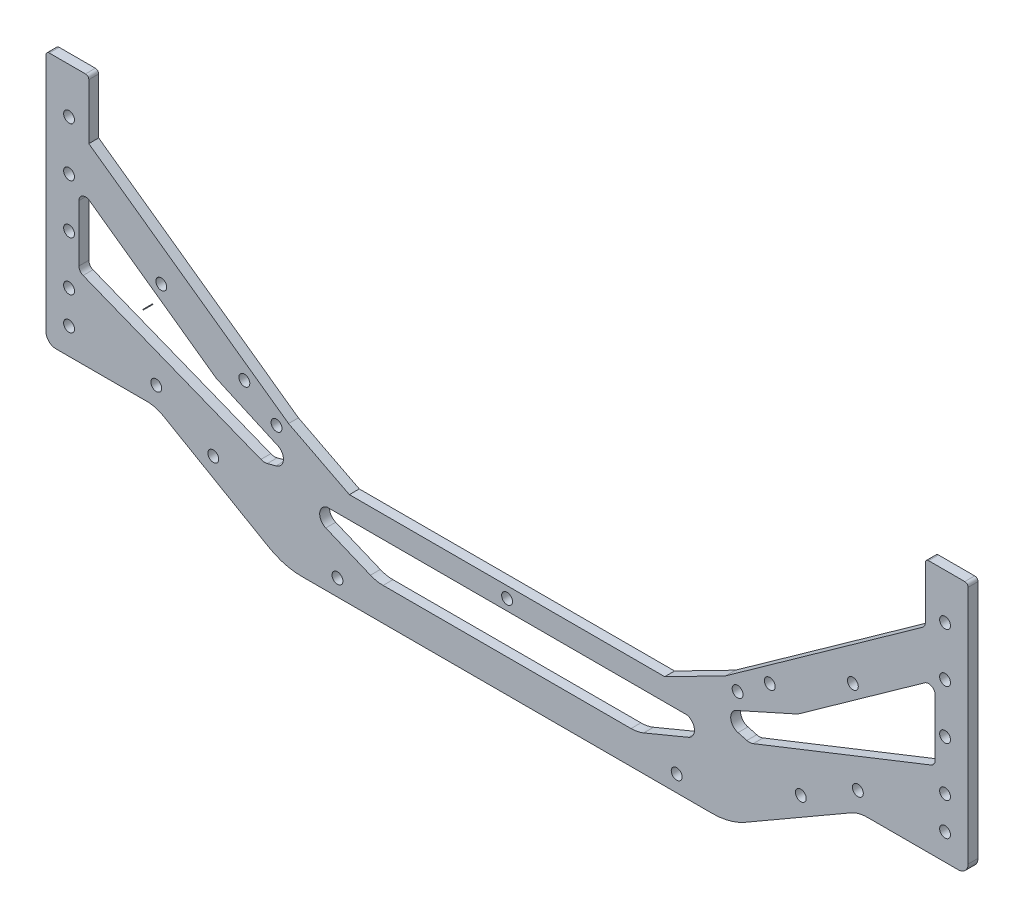
from build123d import *

# Parameters (mm, degrees)
SKETCH_1_R           = 1.65
EXTRUDE_1_DEPTH      = 3
FILLET_1_R           = 20
SKETCH_2_R           = 1.65
CUT_EXTRUDE_1_DEPTH  = 10
EXTRUDE_2_DEPTH      = 3
FILLET_2_R           = 10
EXTRUDE_3_DEPTH      = 3
FILLET_3_R           = 10
FILLET_4_R           = 3
SKETCH_6_R           = 1.65
CUT_EXTRUDE_2_DEPTH  = 5
EXTRUDE_4_DEPTH      = 3
SKETCH_8_R           = 1.65
CUT_EXTRUDE_3_DEPTH  = 10
EXTRUDE_5_DEPTH      = 3
FILLET_5_R           = 3
EXTRUDE_6_DEPTH      = 3
FILLET_6_R           = 2
SKETCH_11_W          = 10
SKETCH_11_H          = 67.386751346
EXTRUDE_7_DEPTH      = 3
SKETCH_14_W          = 280
SKETCH_14_H          = 9.594497852
CUT_EXTRUDE_6_DEPTH  = 30
CUT_EXTRUDE_START    = -10
CUT_EXTRUDE_7_DEPTH  = 10
EXTRUDE_12_DEPTH     = 3
EXTRUDE_15_DEPTH     = 3
CUT_EXTRUDE_10_DEPTH = 10
SKETCH_22_W          = 10
SKETCH_22_H          = 17.468473847
EXTRUDE_16_DEPTH     = 3
CUT_EXTRUDE_11_DEPTH = 10
CUT_EXTRUDE_12_DEPTH = 10
SKETCH_25_W          = 280
SKETCH_25_H          = 3
CUT_EXTRUDE_13_DEPTH = 10
SKETCH_26_W          = 3
SKETCH_26_H          = 35
EXTRUDE_17_DEPTH     = 3
SKETCH_27_R          = 1.65
CUT_EXTRUDE_14_DEPTH = 10
FILLET_7_R           = 1
SKETCH_28_R          = 1.65
EXTRUDE_18_DEPTH     = 3
EXTRUDE_19_DEPTH     = 3
EXTRUDE_20_DEPTH     = 3
CUT_EXTRUDE_15_DEPTH = 192.383166344
CUT_EXTRUDE_16_DEPTH = 192.383166344
SKETCH_33_R          = 1.65
CUT_EXTRUDE_17_DEPTH = 192.383166344
FILLET_8_R           = 2
SKETCH_34_R          = 1.65
EXTRUDE_21_DEPTH     = 3
SKETCH_35_R          = 1.65
CUT_EXTRUDE_18_DEPTH = 10
SKETCH_36_R          = 1.65
CUT_EXTRUDE_19_DEPTH = 10


with BuildPart() as part:
    # 草图1 → 凸台-拉伸1 (new body)
    with BuildSketch(Plane.XY):
        Polygon((91.5, 5), (156.5, 42.527767497), (161.5, 33.867513459), (94.179491924, -5), (-41.179491924, -5), (-108.5, 33.867513459), (-103.5, 42.527767497), (-38.5, 5), align=None)
        with Locations((53, 0)):
            Circle(SKETCH_1_R, mode=Mode.SUBTRACT)
        Circle(SKETCH_1_R, mode=Mode.SUBTRACT)
    extrude(amount=EXTRUDE_1_DEPTH)

    # 圆角1
    fillet_1_edges = [part.edges().sort_by_distance(p)[0] for p in [
        (94.179491924, -5, 1.5),
        (-41.179491924, -5, 1.5),
        (-38.5, 5, 1.5),
        (91.5, 5, 1.5),
    ]]
    fillet(fillet_1_edges, radius=FILLET_1_R)

    # 草图2 → 切除-拉伸1 (cut)
    with BuildSketch(Plane.XY.offset(3)):
        with Locations((-62.698729811, 13.197640478)):
            Circle(SKETCH_2_R)
        with Locations((-80.019237886, 23.197640478)):
            Circle(SKETCH_2_R)
        with Locations((133.019237886, 23.197640478)):
            Circle(SKETCH_2_R)
        with Locations((115.698729811, 13.197640478)):
            Circle(SKETCH_2_R)
        with Locations((-25, 0)):
            Circle(SKETCH_2_R)
        with Locations((78, 0)):
            Circle(SKETCH_2_R)
    extrude(amount=-CUT_EXTRUDE_1_DEPTH, mode=Mode.SUBTRACT)

    # 草图3 → 凸台-拉伸2 (add)
    with BuildSketch(Plane.XY.offset(3)):
        with BuildLine():
            Line((-103.5, 42.527767497), (-13.141016151, 5))
            Line((-13.141016151, 5), (-33.141016151, 5))
            ThreePointArc((-33.141016151, 5), (-38.317397053, 5.681483474), (-43.141016151, 7.679491924))
            Line((-43.141016151, 7.679491924), (-103.5, 42.527767497))
        make_face()
        with BuildLine():
            Line((156.5, 42.527767497), (66.141016151, 5))
            Line((66.141016151, 5), (86.141016151, 5))
            ThreePointArc((86.141016151, 5), (91.317397053, 5.681483474), (96.141016151, 7.679491924))
            Line((96.141016151, 7.679491924), (156.5, 42.527767497))
        make_face()
    extrude(amount=-EXTRUDE_2_DEPTH)

    # 圆角2
    fillet_2_edges = [part.edges().sort_by_distance(p)[0] for p in [
        (66.141016151, 5, 1.5),
        (-13.141016151, 5, 1.5),
    ]]
    fillet(fillet_2_edges, radius=FILLET_2_R)

    # 草图4 → 凸台-拉伸3 (add)
    with BuildSketch(Plane.XY.offset(3)):
        Polygon((-103.5, 42.527767497), (-108.5, 33.867513459), (-80.198729811, 17.527767497), (-113.5, 17.527767497), (-113.5, 42.527767497), align=None)
        Polygon((166.5, 17.527767497), (166.5, 42.527767497), (156.5, 42.527767497), (161.5, 33.867513459), (133.198729811, 17.527767497), align=None)
    extrude(amount=-EXTRUDE_3_DEPTH)

    # 圆角3
    fillet_3_edges = [part.edges().sort_by_distance(p)[0] for p in [
        (-80.198729811, 17.527767497, 1.5),
        (133.198729811, 17.527767497, 1.5),
    ]]
    fillet(fillet_3_edges, radius=FILLET_3_R)

    # 圆角4
    fillet_4_edges = [part.edges().sort_by_distance(p)[0] for p in [
        (-113.5, 42.527767497, 1.5),
        (-113.5, 17.527767497, 1.5),
        (166.5, 17.527767497, 1.5),
        (166.5, 42.527767497, 1.5),
    ]]
    fillet(fillet_4_edges, radius=FILLET_4_R)

    # 草图6 → 切除-拉伸2 (cut)
    with BuildSketch(Plane.XY.offset(3)):
        with Locations((-106.5, 35.527767497)):
            Circle(SKETCH_6_R)
        with Locations((-106.5, 25.527767497)):
            Circle(SKETCH_6_R)
        with Locations((159.5, 25.527767497)):
            Circle(SKETCH_6_R)
        with Locations((159.5, 35.527767497)):
            Circle(SKETCH_6_R)
    extrude(amount=-CUT_EXTRUDE_2_DEPTH, mode=Mode.SUBTRACT)

    # 草图7 → 凸台-拉伸4 (add)
    with BuildSketch(Plane.XY.offset(3)):
        Polygon((-47.30740392, 19.189936648), (-13.5, 28.248603227), (26.5, 28.248603227), (66.5, 28.248603227), (100.30740392, 19.189936648), (98.495670604, 12.428455864), (65.578432517, 21.248603227), (26.5, 21.248603227), (-12.578432517, 21.248603227), (-45.495670604, 12.428455864), align=None)
    extrude(amount=-EXTRUDE_4_DEPTH)

    # 草图8 → 切除-拉伸3 (cut)
    with BuildSketch(Plane.XY.offset(3)):
        with Locations((-106.5, 25.527767497)):
            Circle(SKETCH_8_R)
        with Locations((-106.5, 35.527767497)):
            Circle(SKETCH_8_R)
        with Locations((-98.5, 35.527767497)):
            Circle(SKETCH_8_R)
        with Locations((-98.5, 25.527767497)):
            Circle(SKETCH_8_R)
        with Locations((151.5, 25.527767497)):
            Circle(SKETCH_8_R)
        with Locations((151.5, 35.527767497)):
            Circle(SKETCH_8_R)
        with Locations((159.5, 35.527767497)):
            Circle(SKETCH_8_R)
        with Locations((159.5, 25.527767497)):
            Circle(SKETCH_8_R)
    extrude(amount=-CUT_EXTRUDE_3_DEPTH, mode=Mode.SUBTRACT)

    # 草图9 → 凸台-拉伸5 (add)
    with BuildSketch(Plane.XY.offset(3)):
        Polygon((-13.5, 28.248603227), (-110.911809549, 54.350018929), (-113.5, 44.690760666), (-32.818516526, 23.072222325), align=None)
        Polygon((166.5, 44.690760666), (85.818516526, 23.072222325), (66.5, 28.248603227), (163.911809549, 54.350018929), align=None)
    extrude(amount=-EXTRUDE_5_DEPTH)

    # 圆角5
    fillet_5_edges = [part.edges().sort_by_distance(p)[0] for p in [
        (89.701118587, 14.784948975, 1.5),
        (-36.701118587, 14.784948975, 1.5),
        (-47.30740392, 19.189936648, 1.5),
        (-13.5, 28.248603227, 1.5),
        (66.5, 28.248603227, 1.5),
        (100.30740392, 19.189936648, 1.5),
        (65.578432517, 21.248603227, 1.5),
        (-12.578432517, 21.248603227, 1.5),
        (-32.818516526, 23.072222325, 1.5),
        (-113.5, 44.690760666, 1.5),
        (-110.911809549, 54.350018929, 1.5),
        (163.911809549, 54.350018929, 1.5),
        (166.5, 44.690760666, 1.5),
        (85.818516526, 23.072222325, 1.5),
    ]]
    fillet(fillet_5_edges, radius=FILLET_5_R)

    # 草图10 → 凸台-拉伸6 (add)
    with BuildSketch(Plane.XY.offset(3)):
        Polygon((-108.357699123, 67.863132863), (-113.5, 61.734777318), (-101.784601755, 51.904390971), (-83.5, 47.005046697), align=None)
        Polygon((136.5, 47.005046697), (161.357699123, 67.863132863), (166.5, 61.734777318), (154.784601755, 51.904390971), align=None)
    extrude(amount=-EXTRUDE_6_DEPTH)

    # 圆角6
    fillet_6_edges = [part.edges().sort_by_distance(p)[0] for p in [
        (161.357699123, 67.863132863, 1.5),
        (166.5, 61.734777318, 1.5),
        (154.784601755, 51.904390971, 1.5),
        (136.5, 47.005046697, 1.5),
        (-83.5, 47.005046697, 1.5),
        (-101.784601755, 51.904390971, 1.5),
        (-108.357699123, 67.863132863, 1.5),
        (-113.5, 61.734777318, 1.5),
    ]]
    fillet(fillet_6_edges, radius=FILLET_6_R)

    # 草图11 → 凸台-拉伸7 (add)
    with BuildSketch(Plane.XY.offset(3)):
        with Locations((-108.5, 73.22114317)):
            Rectangle(SKETCH_11_W, SKETCH_11_H)
        with Locations((161.5, 73.22114317)):
            Rectangle(SKETCH_11_W, SKETCH_11_H)
    extrude(amount=-EXTRUDE_7_DEPTH)

    # 草图14 → 切除-拉伸6 (cut)
    with BuildSketch(Plane.XY.offset(3)):
        with Locations((26.5, 102.117269917)):
            Rectangle(SKETCH_14_W, SKETCH_14_H)
    extrude(amount=-CUT_EXTRUDE_6_DEPTH, mode=Mode.SUBTRACT)

    # 草图15 → 切除-拉伸7 (cut)
    with BuildSketch(Plane.XY.offset(3).offset(CUT_EXTRUDE_START)):
        with BuildLine():
            Line((-48.249337431, 19.581139164), (-113.5, 45.414518843))
            Line((-113.5, 45.414518843), (-113.5, 58.923894244))
            Line((-113.5, 58.923894244), (-71.81419, 33.52108154))
            Line((-71.81419, 33.52108154), (-43.633169306, 25.969999804))
            ThreePointArc((-43.633169306, 25.969999804), (-41.409626441, 23.072222325), (-43.633169306, 20.174444846))
            Line((-43.633169306, 20.174444846), (-46.322217276, 19.453916614))
            ThreePointArc((-46.322217276, 19.453916614), (-47.29629502, 19.358210154), (-48.249337431, 19.581139164))
        make_face()
        with BuildLine():
            Line((124.81419, 33.52108154), (96.633169306, 25.969999804))
            ThreePointArc((96.633169306, 25.969999804), (94.409626441, 23.072222325), (96.633169306, 20.174444846))
            Line((96.633169306, 20.174444846), (99.322217276, 19.453916614))
            ThreePointArc((99.322217276, 19.453916614), (100.29629502, 19.358210154), (101.249337431, 19.581139164))
            Line((101.249337431, 19.581139164), (166.5, 45.414518843))
            Line((166.5, 45.414518843), (166.5, 58.923894244))
            Line((166.5, 58.923894244), (124.81419, 33.52108154))
        make_face()
    extrude(amount=CUT_EXTRUDE_7_DEPTH, mode=Mode.SUBTRACT)

    # 草图16 → 凸台-拉伸12 (add)
    with BuildSketch(Plane.XY.offset(3)):
        Polygon((-48.476609221, 37.620557422), (-84.079864377, 40.954872502), (-103.5, 62.787039321), (-103.5, 65.787039321), align=None)
        Polygon((101.476609221, 37.620557422), (136.723834597, 40.954872502), (156.5, 62.787039321), (156.5, 65.787039321), align=None)
    extrude(amount=-EXTRUDE_12_DEPTH)

    # 草图20 → 凸台-拉伸15 (add)
    with BuildSketch(Plane.XY.offset(3)):
        Polygon((81.177744498, 17.068780179), (-28.177744498, 17.068780179), (-12.183475024, 24.145273244), (57.513790466, 24.145273244), align=None)
    extrude(amount=-EXTRUDE_15_DEPTH)

    # 草图21 → 切除-拉伸10 (cut)
    with BuildSketch(Plane(origin=(0, 0, 0), x_dir=(-1, 0, 0), z_dir=(0, 0, -1))):
        Polygon((-101.476609221, 37.620557422), (-74.37766377, 23.748603227), (21.37766377, 23.748603227), (46.90096027, 36.81398249), align=None)
    extrude(amount=-CUT_EXTRUDE_10_DEPTH, mode=Mode.SUBTRACT)

    # 草图22 → 凸台-拉伸16 (add)
    with BuildSketch(Plane.XY.offset(3)):
        with Locations((-108.5, 50.189657321)):
            Rectangle(SKETCH_22_W, SKETCH_22_H)
        with Locations((161.5, 50.189657321)):
            Rectangle(SKETCH_22_W, SKETCH_22_H)
    extrude(amount=-EXTRUDE_16_DEPTH)

    # 草图23 → 切除-拉伸11 (cut)
    with BuildSketch(Plane.XY.offset(3)):
        Polygon((-103.5, 52.830018965), (-43.633169306, 25.969999804), (-71.81419, 33.52108154), align=None)
        Polygon((96.633169306, 25.969999804), (156.5, 52.830018965), (124.81419, 33.52108154), align=None)
    extrude(amount=-CUT_EXTRUDE_11_DEPTH, mode=Mode.SUBTRACT)


with BuildPart() as cut_extrude_11_piece_1:
    # of the separate pieces the step leaves, piece 1, a body of its own (cut_extrude_11_pieces)
    add(part.part.solids().sort_by_distance((-113.5, 20.527767497, 0))[0])

    # 草图24 → 切除-拉伸12 (cut)
    with BuildSketch(Plane.XY.offset(3)):
        Polygon((-46.90096027, 36.81398249), (-54.036757868, 40.466798338), (-39.643004165, 38.640390414), (-44.361834349, 35.514203554), align=None)
    extrude(amount=-CUT_EXTRUDE_12_DEPTH, mode=Mode.SUBTRACT)

    # 草图25 → 切除-拉伸13 (cut)
    with BuildSketch(Plane.XY.offset(3)):
        with Locations((26.5, 95.820020991)):
            Rectangle(SKETCH_25_W, SKETCH_25_H)
    extrude(amount=-CUT_EXTRUDE_13_DEPTH, mode=Mode.SUBTRACT)

    # 草图26 → 凸台-拉伸17 (add)
    with BuildSketch(Plane.XY.offset(3)):
        with Locations((-102, 76.820020991)):
            Rectangle(SKETCH_26_W, SKETCH_26_H)
        with Locations((155, 76.820020991)):
            Rectangle(SKETCH_26_W, SKETCH_26_H)
    extrude(amount=-EXTRUDE_17_DEPTH)

    # 草图27 → 切除-拉伸14 (cut)
    with BuildSketch(Plane.XY.offset(3)):
        with Locations((-106.5, 65.527767497)):
            Circle(SKETCH_27_R)
        with Locations((-106.5, 80.527767497)):
            Circle(SKETCH_27_R)
        with Locations((159.5, 65.527767497)):
            Circle(SKETCH_27_R)
        with Locations((159.5, 80.527767497)):
            Circle(SKETCH_27_R)
        with Locations((-106.5, 50.527767497)):
            Circle(SKETCH_27_R)
        with Locations((159.5, 50.527767497)):
            Circle(SKETCH_27_R)
    extrude(amount=-CUT_EXTRUDE_14_DEPTH, mode=Mode.SUBTRACT)

    # 圆角7
    fillet_7_edges = [cut_extrude_11_piece_1.edges().sort_by_distance(p)[0] for p in [
        (166.5, 94.320020991, 1.5),
        (-113.5, 94.320020991, 1.5),
        (-100.5, 94.320020991, 1.5),
        (153.5, 94.320020991, 1.5),
    ]]
    fillet(fillet_7_edges, radius=FILLET_7_R)

    # 草图28 → 凸台-拉伸18 (add)
    with BuildSketch(Plane.XY.offset(3)):
        with Locations((-98.5, 25.527767497)):
            Circle(SKETCH_28_R)
        with Locations((-98.5, 35.527767497)):
            Circle(SKETCH_28_R)
        with Locations((151.5, 25.527767497)):
            Circle(SKETCH_28_R)
        with Locations((151.5, 35.527767497)):
            Circle(SKETCH_28_R)
    extrude(amount=-EXTRUDE_18_DEPTH)

    # 草图29 → 凸台-拉伸19 (add)
    with BuildSketch(Plane.XY.offset(3)):
        Polygon((-100.5, 82.608021221), (-27.340106212, 23.016774833), (-43.633169306, 25.969999804), (-100.5, 72.289986667), align=None)
    extrude_19 = extrude(amount=-EXTRUDE_19_DEPTH)

    # 草图30 → 凸台-拉伸20 (add)
    with BuildSketch(Plane.XY.offset(3)):
        Polygon((-100.5, 72.289986667), (-100.5, 64.251338876), (-73.937741675, 50.6541149), align=None)
    extrude_20 = extrude(amount=-EXTRUDE_20_DEPTH)

    # 草图31 → 切除-拉伸15 (cut, through all)
    with BuildSketch(Plane.XY.offset(3)):
        Polygon((-103.5, 52.830018965), (-103.5, 60.602994456), (-53.194373168, 23.243964475), align=None)
        Polygon((-100.5, 82.608021221), (-100.5, 78.247244804), (-39.843661881, 33.201350398), align=None)
    cut_extrude_15 = extrude(amount=-CUT_EXTRUDE_15_DEPTH, mode=Mode.SUBTRACT)

    # 草图32 → 切除-拉伸16 (cut, through all)
    with BuildSketch(Plane.XY.offset(3)):
        Polygon((-103.5, 60.602994456), (-103.5, 63.876953661), (-61.782748262, 34.113040497), (-77.059364407, 40.967089687), align=None)
        Polygon((-100.5, 78.247244804), (-100.5, 76.477690651), (-39.843661881, 33.201350398), align=None)
    cut_extrude_16 = extrude(amount=-CUT_EXTRUDE_16_DEPTH, mode=Mode.SUBTRACT)

    # 镜向1: 凸台-拉伸19, 凸台-拉伸20, 切除-拉伸15, 切除-拉伸16 across plane
    add(extrude_19.mirror(Plane.ZY.offset(-26.5)))
    add(extrude_20.mirror(Plane.ZY.offset(-26.5)))
    add(cut_extrude_15.mirror(Plane.ZY.offset(-26.5)), mode=Mode.SUBTRACT)
    add(cut_extrude_16.mirror(Plane.ZY.offset(-26.5)), mode=Mode.SUBTRACT)

    # 草图33 → 切除-拉伸17 (cut, through all)
    with BuildSketch(Plane.XY.offset(3)):
        with Locations((-78.5, 50.527767497)):
            Circle(SKETCH_33_R)
        with Locations(Location((131.5, 50.527767497, 0), (0, 0, 180))):
            Circle(SKETCH_33_R)
    extrude(amount=-CUT_EXTRUDE_17_DEPTH, mode=Mode.SUBTRACT)

    # 圆角8
    fillet_8_edges = [cut_extrude_11_piece_1.edges().sort_by_distance(p)[0] for p in [
        (-103.5, 41.455420397, 1.5),
        (156.5, 41.455420397, 1.5),
        (-103.5, 63.876953661, 1.5),
        (-61.782748262, 34.113040497, 1.5),
        (153.5, 76.477690651, 1.5),
        (114.782748262, 34.113040497, 1.5),
        (156.5, 63.876953661, 1.5),
    ]]
    fillet(fillet_8_edges, radius=FILLET_8_R)

    # 草图34 → 凸台-拉伸21 (add)
    with BuildSketch(Plane.XY.offset(3)):
        Circle(SKETCH_34_R)
        with Locations((53, 0)):
            Circle(SKETCH_34_R)
    extrude(amount=-EXTRUDE_21_DEPTH)

    # 草图35 → 切除-拉伸18 (cut)
    with BuildSketch(Plane(origin=(0, 0, 0), x_dir=(-1, 0, 0), z_dir=(0, 0, -1))):
        with Locations((-106.268579503, 37.865882585)):
            Circle(SKETCH_35_R)
        with Locations((-96.5, 30.89631628)):
            Circle(SKETCH_35_R)
        with Locations(Location((43.5, 30.89631628, 0), (0, 0, 180))):
            Circle(SKETCH_35_R)
        with Locations(Location((53.268579503, 37.865882585, 0), (0, 0, 180))):
            Circle(SKETCH_35_R)
    extrude(amount=-CUT_EXTRUDE_18_DEPTH, mode=Mode.SUBTRACT)

    # 草图36 → 切除-拉伸19 (cut)
    with BuildSketch(Plane(origin=(0, 0, 0), x_dir=(-1, 0, 0), z_dir=(0, 0, -1))):
        with Locations((-26.5, 20.368780179)):
            Circle(SKETCH_36_R)
    extrude(amount=-CUT_EXTRUDE_19_DEPTH, mode=Mode.SUBTRACT)


with BuildPart() as cut_extrude_11_piece_2:
    # of the separate pieces the step leaves, piece 2, a body of its own (cut_extrude_11_pieces)
    add(part.part.solids().sort_by_distance((-84.079864377, 40.954872502, 0))[0])


solid = Compound([cut_extrude_11_piece_1.part, cut_extrude_11_piece_2.part])
